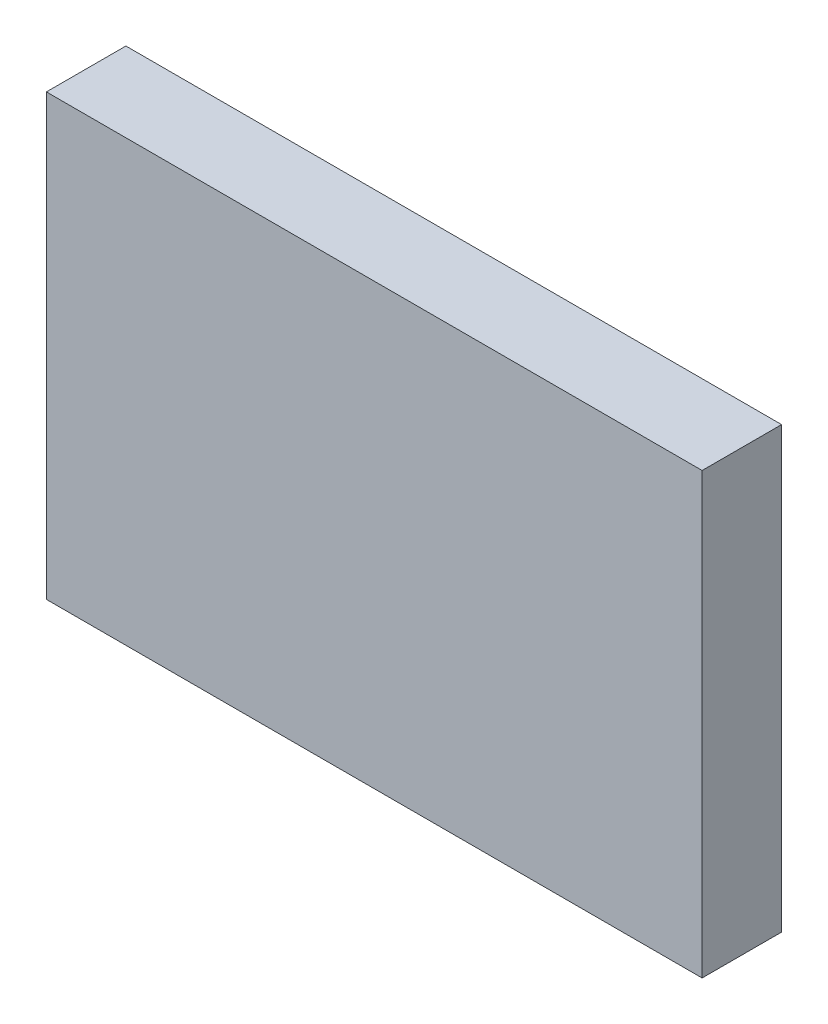
from build123d import *

# Parameters (mm, degrees)
ESQUISSE1_W        = 82.5
ESQUISSE1_H        = 55.3
BOSS_EXTRU_1_DEPTH = 10


with BuildPart() as part:
    # Esquisse1 → Boss.-Extru.1 (new body)
    with BuildSketch(Plane.XY):
        Rectangle(ESQUISSE1_W, ESQUISSE1_H)
    extrude(amount=BOSS_EXTRU_1_DEPTH)


solid = part.part
